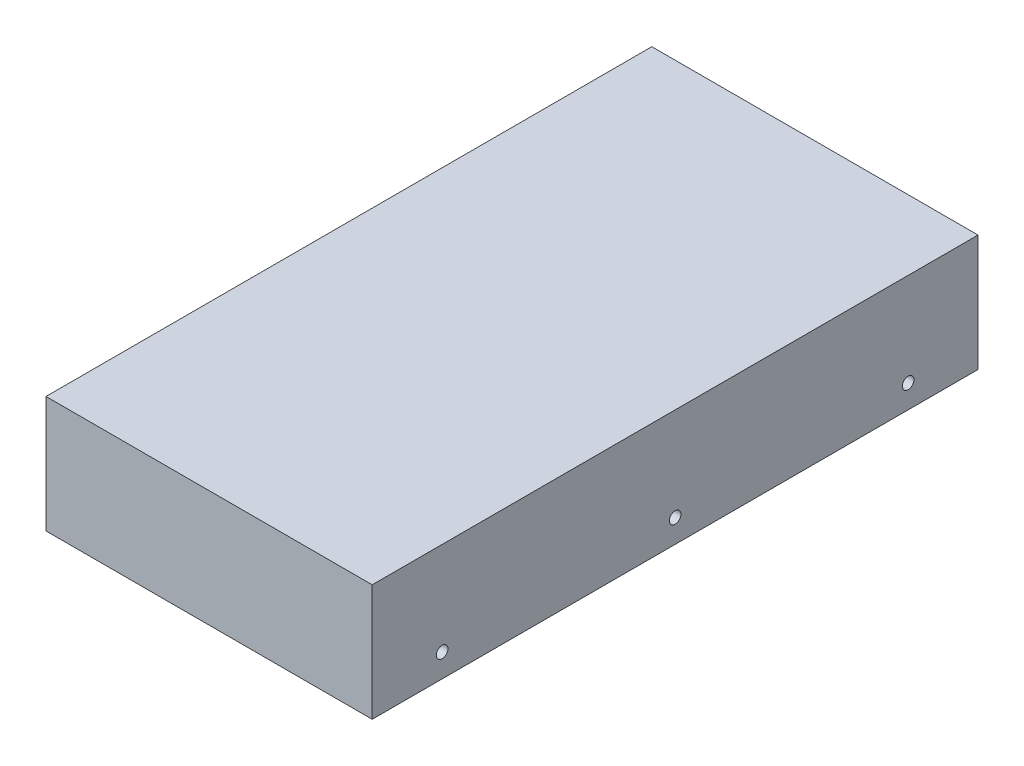
from build123d import *

# Parameters (mm, degrees)
SKETCH2_W           = 660.4
SKETCH2_H           = 127
SKETCH2_R           = 6.35
BOSS_EXTRUDE1_DEPTH = 177.8


with BuildPart() as part:
    # Sketch2 → Boss-Extrude1 (new, symmetric)
    with BuildSketch(Plane(origin=(0, 0, 0), x_dir=(0, 0, -1), z_dir=(1, 0, 0))):
        with Locations((0, 38.1)):
            Rectangle(SKETCH2_W, SKETCH2_H)
        Circle(SKETCH2_R, mode=Mode.SUBTRACT)
        with Locations((-254, 0)):
            Circle(SKETCH2_R, mode=Mode.SUBTRACT)
        with Locations((254, 0)):
            Circle(SKETCH2_R, mode=Mode.SUBTRACT)
    extrude(amount=BOSS_EXTRUDE1_DEPTH, both=True)


solid = part.part
